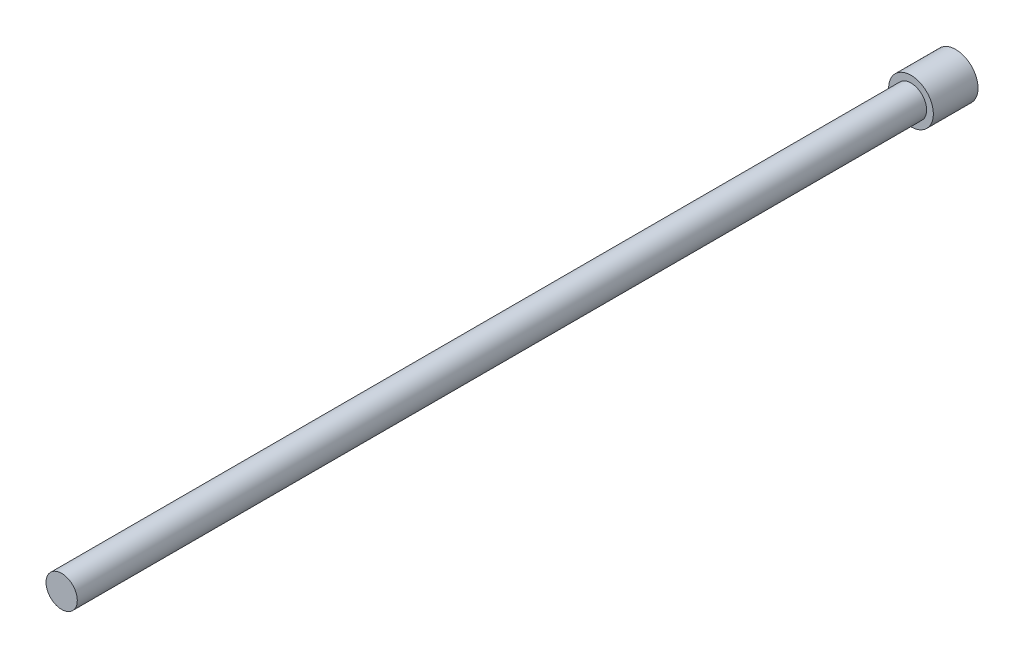
from build123d import *

# Parameters (mm, degrees)
SKETCH_1_R      = 3.5
EXTRUDE_1_DEPTH = 200
SKETCH_2_R      = 5
EXTRUDE_2_DEPTH = 10


with BuildPart() as part:
    # 草图1 → 凸台-拉伸1 (new body)
    with BuildSketch(Plane.XY):
        Circle(SKETCH_1_R)
    extrude(amount=EXTRUDE_1_DEPTH)

    # 草图2 → 凸台-拉伸2 (add)
    with BuildSketch(Plane(origin=(0, 0, 0), x_dir=(-1, 0, 0), z_dir=(0, 0, -1))):
        Circle(SKETCH_2_R)
    extrude(amount=-EXTRUDE_2_DEPTH)


solid = part.part
